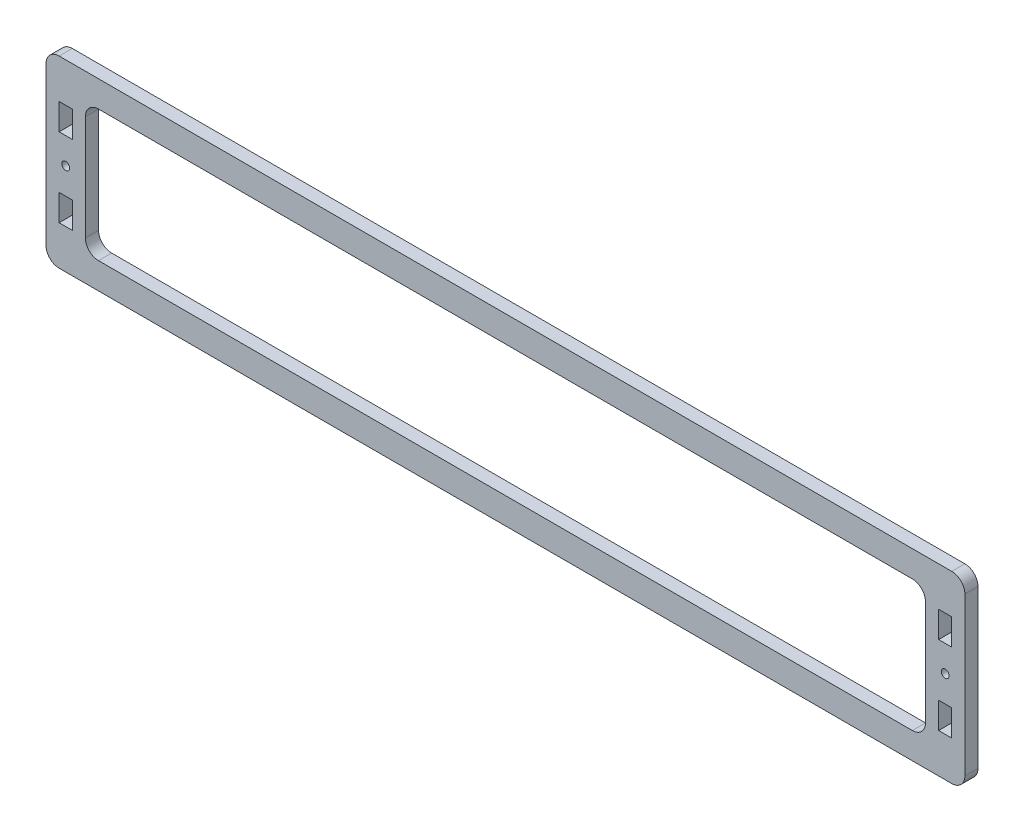
from build123d import *

# Parameters (mm, degrees)
SKETCH1_W               = 350
SKETCH1_H               = 70
SKETCH1_R               = 1.5
SKETCH1_W_2             = 5
SKETCH1_H_2             = 10
BOSS_EXTRUDE1_DEPTH     = 5
ESQUISSE1_W             = 320
ESQUISSE1_H             = 50
ENL_V_MAT_EXTRU_1_DEPTH = 10
CONG_1_R                = 5


with BuildPart() as part:
    # Sketch1 → Boss-Extrude1 (new body)
    with BuildSketch(Plane.XY):
        with Locations((89.186746988, 0)):
            Rectangle(SKETCH1_W, SKETCH1_H)
        with Locations((-78.313253012, 0)):
            Circle(SKETCH1_R, mode=Mode.SUBTRACT)
        with Locations(Location((256.686746988, 0, 0), (0, 0, 180))):
            Circle(SKETCH1_R, mode=Mode.SUBTRACT)
        with Locations((-78.313253012, -15)):
            Rectangle(SKETCH1_W_2, SKETCH1_H_2, mode=Mode.SUBTRACT)
        with Locations((-78.313253012, 15)):
            Rectangle(SKETCH1_W_2, SKETCH1_H_2, mode=Mode.SUBTRACT)
        with Locations((256.686746988, -15)):
            Rectangle(SKETCH1_W_2, SKETCH1_H_2, mode=Mode.SUBTRACT)
        with Locations((256.686746988, 15)):
            Rectangle(SKETCH1_W_2, SKETCH1_H_2, mode=Mode.SUBTRACT)
    extrude(amount=BOSS_EXTRUDE1_DEPTH)

    # Esquisse1 → Enlèv. mat.-Extru.1 (cut)
    with BuildSketch(Plane.XY.offset(5)):
        with Locations((89.186746988, 0)):
            Rectangle(ESQUISSE1_W, ESQUISSE1_H)
    extrude(amount=-ENL_V_MAT_EXTRU_1_DEPTH, mode=Mode.SUBTRACT)

    # Congé1
    cong_1_edges = [part.edges().sort_by_distance(p)[0] for p in [
        (-85.813253012, 35, 2.5),
        (264.186746988, 35, 2.5),
        (264.186746988, -35, 2.5),
        (-85.813253012, -35, 2.5),
        (-70.813253012, -25, 2.5),
        (-70.813253012, 25, 2.5),
        (249.186746988, 25, 2.5),
        (249.186746988, -25, 2.5),
    ]]
    fillet(cong_1_edges, radius=CONG_1_R)


solid = part.part
